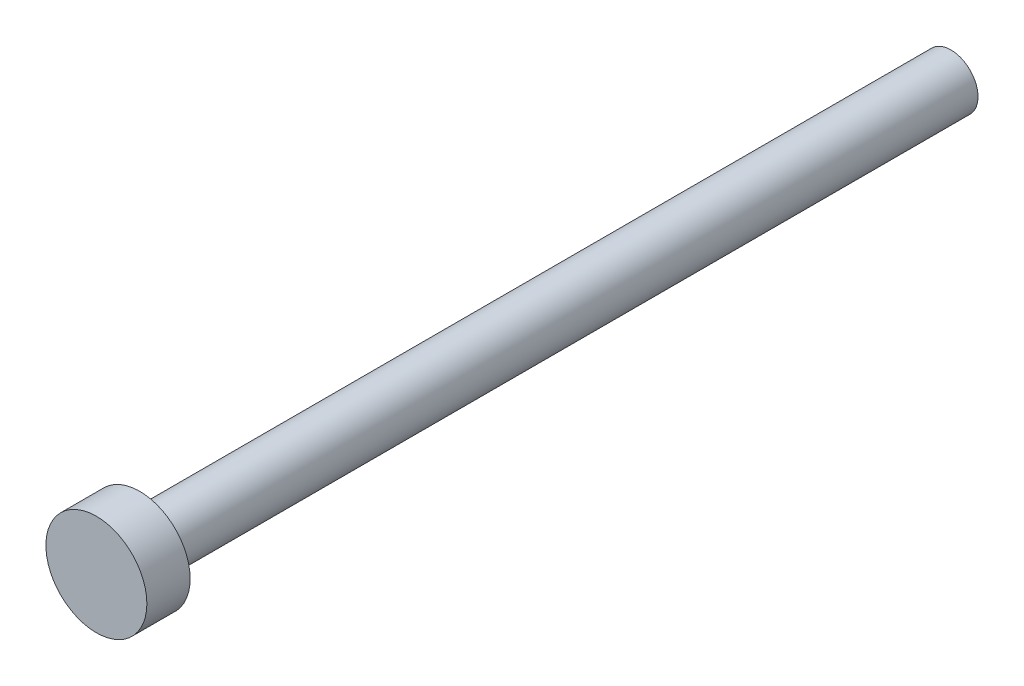
from build123d import *

# Parameters (mm, degrees)
ESQUISSE1_R        = 2.8
BOSS_EXTRU_1_DEPTH = 2.4
ESQUISSE2_R        = 1.5
BOSS_EXTRU_2_DEPTH = 45


with BuildPart() as part:
    # Esquisse1 → Boss.-Extru.1 (new body)
    with BuildSketch(Plane.XY):
        Circle(ESQUISSE1_R)
    extrude(amount=BOSS_EXTRU_1_DEPTH)

    # Esquisse2 → Boss.-Extru.2 (add)
    with BuildSketch(Plane(origin=(0, 0, 0), x_dir=(-1, 0, 0), z_dir=(0, 0, -1))):
        with Locations(Location((0, 0, 0), (0, 0, 180))):
            Circle(ESQUISSE2_R)
    extrude(amount=BOSS_EXTRU_2_DEPTH)


solid = part.part
